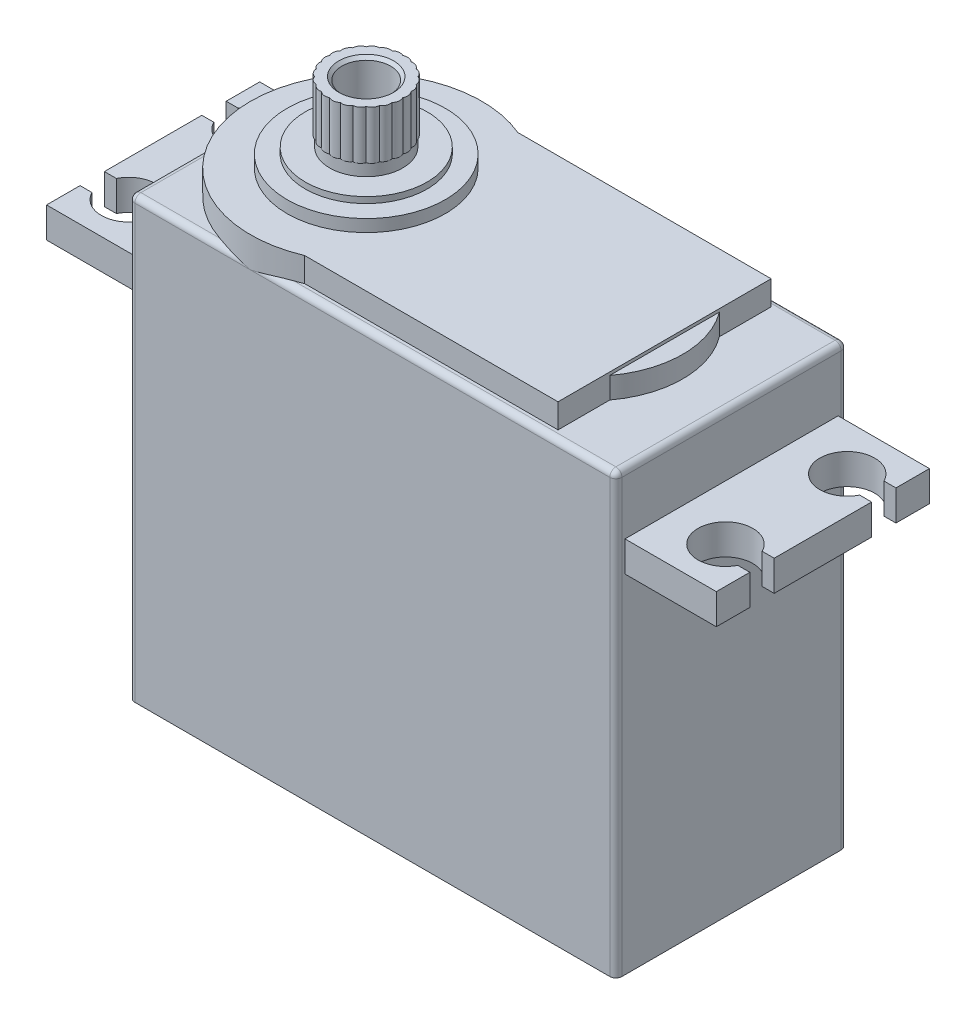
from build123d import *

# Parameters (mm, degrees)
CROQUIS1_W              = 40
CROQUIS1_H              = 19
SALIENTE_EXTRUIR1_DEPTH = 36
SALIENTE_EXTRUIR2_DEPTH = 2.5
REDONDEO1_R             = 0.5
REDONDEO2_R             = 0.5
SALIENTE_EXTRUIR3_DEPTH = 2
SALIENTE_EXTRUIR4_DEPTH = 2
CROQUIS5_R              = 6.5
SALIENTE_EXTRUIR5_DEPTH = 1
CROQUIS6_R              = 5
SALIENTE_EXTRUIR6_DEPTH = 0.5
CROQUIS7_R              = 3
SALIENTE_EXTRUIR7_DEPTH = 5
SALIENTE_EXTRUIR8_START = -4
CROQUIS8_R              = 3
SALIENTE_EXTRUIR8_DEPTH = 4
CROQUIS9_R              = 2
CORTAR_EXTRUIR1_DEPTH   = 5
CHAFL_N1_SIZE           = 0.25
SALIENTE_EXTRUIR9_DEPTH = 1.75


with BuildPart() as part:
    # Croquis1 → Saliente-Extruir1 (new body)
    with BuildSketch(Plane(origin=(0, 0, 0), x_dir=(1, 0, 0), z_dir=(0, 1, 0))):
        with Locations((20, -9.5)):
            Rectangle(CROQUIS1_W, CROQUIS1_H)
    extrude(amount=SALIENTE_EXTRUIR1_DEPTH)

    # Croquis2 → Saliente-Extruir2 (add)
    with BuildSketch(Plane(origin=(0, 31, 0), x_dir=(-1, 0, 0), z_dir=(0, 1, 0))):
        with BuildLine():
            ThreePointArc((-46.515564437, 3.5), (-42.25, 4.5), (-46.515564437, 5.5))
            Line((-46.515564437, 5.5), (-47.5, 5.5))
            Line((-47.5, 5.5), (-47.5, 13.5))
            Line((-47.5, 13.5), (-46.515564437, 13.5))
            ThreePointArc((-46.515564437, 13.5), (-42.25, 14.5), (-46.515564437, 15.5))
            Line((-46.515564437, 15.5), (-47.5, 15.5))
            Line((-47.5, 15.5), (-47.5, 18.25))
            Line((-47.5, 18.25), (-40, 18.25))
            Line((-40, 18.25), (-40, 0.75))
            Line((-40, 0.75), (-47.5, 0.75))
            Line((-47.5, 0.75), (-47.5, 3.5))
            Line((-47.5, 3.5), (-46.515564437, 3.5))
        make_face()
        with BuildLine():
            Line((6.515564437, 13.5), (7.5, 13.5))
            Line((7.5, 13.5), (7.5, 5.5))
            Line((7.5, 5.5), (6.515564437, 5.5))
            ThreePointArc((6.515564437, 5.5), (2.25, 4.5), (6.515564437, 3.5))
            Line((6.515564437, 3.5), (7.5, 3.5))
            Line((7.5, 3.5), (7.5, 0.75))
            Line((7.5, 0.75), (0, 0.75))
            Line((0, 0.75), (0, 18.25))
            Line((0, 18.25), (7.5, 18.25))
            Line((7.5, 18.25), (7.5, 15.5))
            Line((7.5, 15.5), (6.515564437, 15.5))
            ThreePointArc((6.515564437, 15.5), (2.25, 14.5), (6.515564437, 13.5))
        make_face()
    extrude(amount=-SALIENTE_EXTRUIR2_DEPTH)

    # Redondeo1
    redondeo1_edges = [part.edges().sort_by_distance(p)[0] for p in [
        (0, 18, 0),
        (40, 18, 0),
        (40, 18, 19),
        (0, 18, 19),
    ]]
    fillet(redondeo1_edges, radius=REDONDEO1_R)

    # Redondeo2
    redondeo2_edges = [part.edges().sort_by_distance(p)[0] for p in [
        (0, 36, 9.5),
        (20, 36, 0),
        (20, 36, 19),
        (40, 36, 9.5),
        (39.853553391, 36, 18.853553391),
        (39.853553391, 36, 0.146446609),
        (0.146446609, 36, 18.853553391),
        (0.146446609, 36, 0.146446609),
    ]]
    fillet(redondeo2_edges, radius=REDONDEO2_R)

    # Croquis3 → Saliente-Extruir3 (add)
    with BuildSketch(Plane(origin=(0, 36, 0), x_dir=(1, 0, 0), z_dir=(0, 1, 0))):
        with BuildLine():
            Line((34.5, -18.25), (34.5, -0.75))
            Line((34.5, -0.75), (14.5, -0.75))
            Line((14.5, -0.75), (13.699662147, -0.75))
            ThreePointArc((13.699662147, -0.75), (17.918231823, -4.25103774), (19.5, -9.5))
            ThreePointArc((19.5, -9.5), (17.918231823, -14.74896226), (13.699662147, -18.25))
            Line((13.699662147, -18.25), (14.5, -18.25))
            Line((14.5, -18.25), (34.5, -18.25))
        make_face()
    extrude(amount=SALIENTE_EXTRUIR3_DEPTH)

    # Croquis4 → Saliente-Extruir4 (add, symmetric)
    with BuildSketch(Plane(origin=(0, 36, 0), x_dir=(1, 0, 0), z_dir=(0, 1, 0))):
        with BuildLine():
            ThreePointArc((19.5, -9.5), (17.918231823, -4.25103774), (13.699662147, -0.75))
            ThreePointArc((13.699662147, -0.75), (13.3728388, -0.618898805), (13.041381265, -0.5))
            Line((13.041381265, -0.5), (6.958618735, -0.5))
            ThreePointArc((6.958618735, -0.5), (0.5, -9.5), (6.958618735, -18.5))
            Line((6.958618735, -18.5), (13.041381265, -18.5))
            ThreePointArc((13.041381265, -18.5), (13.3728388, -18.381101195), (13.699662147, -18.25))
            ThreePointArc((13.699662147, -18.25), (17.918231823, -14.74896226), (19.5, -9.5))
        make_face()
        with BuildLine():
            ThreePointArc((6.958618735, -18.5), (10, -19), (13.041381265, -18.5))
            Line((13.041381265, -18.5), (6.958618735, -18.5))
        make_face()
        with BuildLine():
            Line((6.958618735, -0.5), (13.041381265, -0.5))
            ThreePointArc((13.041381265, -0.5), (10, 0), (6.958618735, -0.5))
        make_face()
    extrude(amount=SALIENTE_EXTRUIR4_DEPTH, both=True)

    # Croquis5 → Saliente-Extruir5 (add)
    with BuildSketch(Plane(origin=(0, 38, 0), x_dir=(1, 0, 0), z_dir=(0, 1, 0))):
        with Locations(Location((10, -9.5, 0), (0, 0, 270))):
            Circle(CROQUIS5_R)
    extrude(amount=SALIENTE_EXTRUIR5_DEPTH)

    # Croquis6 → Saliente-Extruir6 (add)
    with BuildSketch(Plane(origin=(0, 39, 0), x_dir=(1, 0, 0), z_dir=(0, 1, 0))):
        with Locations(Location((10, -9.5, 0), (0, 0, 270))):
            Circle(CROQUIS6_R)
    extrude(amount=SALIENTE_EXTRUIR6_DEPTH)

    # Croquis7 → Saliente-Extruir7 (add)
    with BuildSketch(Plane(origin=(0, 39.5, 0), x_dir=(1, 0, 0), z_dir=(0, 1, 0))):
        with Locations(Location((10, -9.5, 0), (0, 0, 270))):
            Circle(CROQUIS7_R)
    extrude(amount=SALIENTE_EXTRUIR7_DEPTH)

    # Croquis8 → Saliente-Extruir8 (add)
    with BuildSketch(Plane(origin=(0, 44.5, 0), x_dir=(1, 0, 0), z_dir=(0, 1, 0)).offset(SALIENTE_EXTRUIR8_START)):
        with Locations(Location((10, -9.5, 0), (0, 0, 270))):
            Circle(CROQUIS8_R)
        with BuildLine():
            ThreePointArc((8.5, -6.901923789), (8.11283957, -7.040604645), (7.878679656, -7.378679656))
            ThreePointArc((7.878679656, -7.378679656), (8.173715713, -7.119939979), (8.5, -6.901923789))
        make_face()
        with BuildLine():
            ThreePointArc((9.223542865, -6.602222521), (8.81368136, -6.635973449), (8.5, -6.901923789))
            ThreePointArc((8.5, -6.901923789), (8.851949703, -6.728361402), (9.223542865, -6.602222521))
        make_face()
        with BuildLine():
            ThreePointArc((10, -6.5), (9.595368804, -6.42652093), (9.223542865, -6.602222521))
            ThreePointArc((9.223542865, -6.602222521), (9.608421423, -6.525665416), (10, -6.5))
        make_face()
        with BuildLine():
            ThreePointArc((10.776457135, -6.602222521), (10.404631196, -6.42652093), (10, -6.5))
            ThreePointArc((10, -6.5), (10.391578577, -6.525665416), (10.776457135, -6.602222521))
        make_face()
        with BuildLine():
            ThreePointArc((11.5, -6.901923789), (11.18631864, -6.635973449), (10.776457135, -6.602222521))
            ThreePointArc((10.776457135, -6.602222521), (11.148050297, -6.728361402), (11.5, -6.901923789))
        make_face()
        with BuildLine():
            ThreePointArc((12.121320344, -7.378679656), (11.88716043, -7.040604645), (11.5, -6.901923789))
            ThreePointArc((11.5, -6.901923789), (11.826284287, -7.119939979), (12.121320344, -7.378679656))
        make_face()
        with BuildLine():
            ThreePointArc((12.598076211, -8), (12.771638598, -8.351949703), (12.897777479, -8.723542865))
            ThreePointArc((12.897777479, -8.723542865), (12.864026551, -8.31368136), (12.598076211, -8))
        make_face()
        with BuildLine():
            ThreePointArc((12.897777479, -8.723542865), (12.974334584, -9.108421423), (13, -9.5))
            ThreePointArc((13, -9.5), (13.07347907, -9.095368804), (12.897777479, -8.723542865))
        make_face()
        with BuildLine():
            ThreePointArc((12.121320344, -7.378679656), (12.380060021, -7.673715713), (12.598076211, -8))
            ThreePointArc((12.598076211, -8), (12.459395355, -7.61283957), (12.121320344, -7.378679656))
        make_face()
        with BuildLine():
            ThreePointArc((7.878679656, -7.378679656), (7.540604645, -7.61283957), (7.401923789, -8))
            ThreePointArc((7.401923789, -8), (7.619939979, -7.673715713), (7.878679656, -7.378679656))
        make_face()
        with BuildLine():
            ThreePointArc((7.401923789, -11), (7.440963384, -11.204433973), (7.540604645, -11.38716043))
            ThreePointArc((7.540604645, -11.38716043), (7.691315793, -11.530699585), (7.878679656, -11.621320344))
            ThreePointArc((7.878679656, -11.621320344), (7.619939979, -11.326284287), (7.401923789, -11))
        make_face()
        with BuildLine():
            ThreePointArc((7.102222521, -10.276457135), (7.135973449, -10.68631864), (7.401923789, -11))
            ThreePointArc((7.401923789, -11), (7.228361402, -10.648050297), (7.102222521, -10.276457135))
        make_face()
        with BuildLine():
            ThreePointArc((7, -9.5), (6.92652093, -9.904631196), (7.102222521, -10.276457135))
            ThreePointArc((7.102222521, -10.276457135), (7.025665416, -9.891578577), (7, -9.5))
        make_face()
        with BuildLine():
            ThreePointArc((7.102222521, -8.723542865), (6.92652093, -9.095368804), (7, -9.5))
            ThreePointArc((7, -9.5), (7.025665416, -9.108421423), (7.102222521, -8.723542865))
        make_face()
        with BuildLine():
            ThreePointArc((7.401923789, -8), (7.135973449, -8.31368136), (7.102222521, -8.723542865))
            ThreePointArc((7.102222521, -8.723542865), (7.228361402, -8.351949703), (7.401923789, -8))
        make_face()
        with BuildLine():
            ThreePointArc((7.878679656, -11.621320344), (7.969300415, -11.808684207), (8.11283957, -11.959395355))
            ThreePointArc((8.11283957, -11.959395355), (8.295566027, -12.059036616), (8.5, -12.098076211))
            ThreePointArc((8.5, -12.098076211), (8.173715713, -11.880060021), (7.878679656, -11.621320344))
        make_face()
        with BuildLine():
            ThreePointArc((9.223542865, -12.397777479), (8.851949703, -12.271638598), (8.5, -12.098076211))
            ThreePointArc((8.5, -12.098076211), (8.81368136, -12.364026551), (9.223542865, -12.397777479))
        make_face()
        with BuildLine():
            ThreePointArc((10, -12.5), (9.608421423, -12.474334584), (9.223542865, -12.397777479))
            ThreePointArc((9.223542865, -12.397777479), (9.595368804, -12.57347907), (10, -12.5))
        make_face()
        with BuildLine():
            ThreePointArc((10.776457135, -12.397777479), (10.391578577, -12.474334584), (10, -12.5))
            ThreePointArc((10, -12.5), (10.404631196, -12.57347907), (10.776457135, -12.397777479))
        make_face()
        with BuildLine():
            ThreePointArc((11.5, -12.098076211), (11.148050297, -12.271638598), (10.776457135, -12.397777479))
            ThreePointArc((10.776457135, -12.397777479), (11.18631864, -12.364026551), (11.5, -12.098076211))
        make_face()
        with BuildLine():
            ThreePointArc((12.121320344, -11.621320344), (11.826284287, -11.880060021), (11.5, -12.098076211))
            ThreePointArc((11.5, -12.098076211), (11.88716043, -11.959395355), (12.121320344, -11.621320344))
        make_face()
        with BuildLine():
            ThreePointArc((12.598076211, -11), (12.380060021, -11.326284287), (12.121320344, -11.621320344))
            ThreePointArc((12.121320344, -11.621320344), (12.459395355, -11.38716043), (12.598076211, -11))
        make_face()
        with BuildLine():
            ThreePointArc((12.897777479, -10.276457135), (12.771638598, -10.648050297), (12.598076211, -11))
            ThreePointArc((12.598076211, -11), (12.864026551, -10.68631864), (12.897777479, -10.276457135))
        make_face()
        with BuildLine():
            ThreePointArc((13, -9.5), (12.974334584, -9.891578577), (12.897777479, -10.276457135))
            ThreePointArc((12.897777479, -10.276457135), (13.07347907, -9.904631196), (13, -9.5))
        make_face()
    extrude(amount=SALIENTE_EXTRUIR8_DEPTH)

    # Croquis9 → Cortar-Extruir1 (cut)
    with BuildSketch(Plane(origin=(0, 44.5, 0), x_dir=(1, 0, 0), z_dir=(0, 1, 0))):
        with Locations(Location((10, -9.5, 0), (0, 0, 270))):
            Circle(CROQUIS9_R)
    extrude(amount=-CORTAR_EXTRUIR1_DEPTH, mode=Mode.SUBTRACT)

    # Chaflán1
    chafl_n1_edges = [part.edges().sort_by_distance(p)[0] for p in [
        (10, 44.5, 7.5),
    ]]
    chamfer(chafl_n1_edges, length=CHAFL_N1_SIZE)

    # Croquis10 → Saliente-Extruir9 (add)
    with BuildSketch(Plane(origin=(0, 36, 0), x_dir=(1, 0, 0), z_dir=(0, 1, 0))):
        with BuildLine():
            ThreePointArc((34.5, -14), (36, -9.5), (34.5, -5))
            Line((34.5, -5), (34.5, -14))
        make_face()
    extrude(amount=SALIENTE_EXTRUIR9_DEPTH)


solid = part.part
